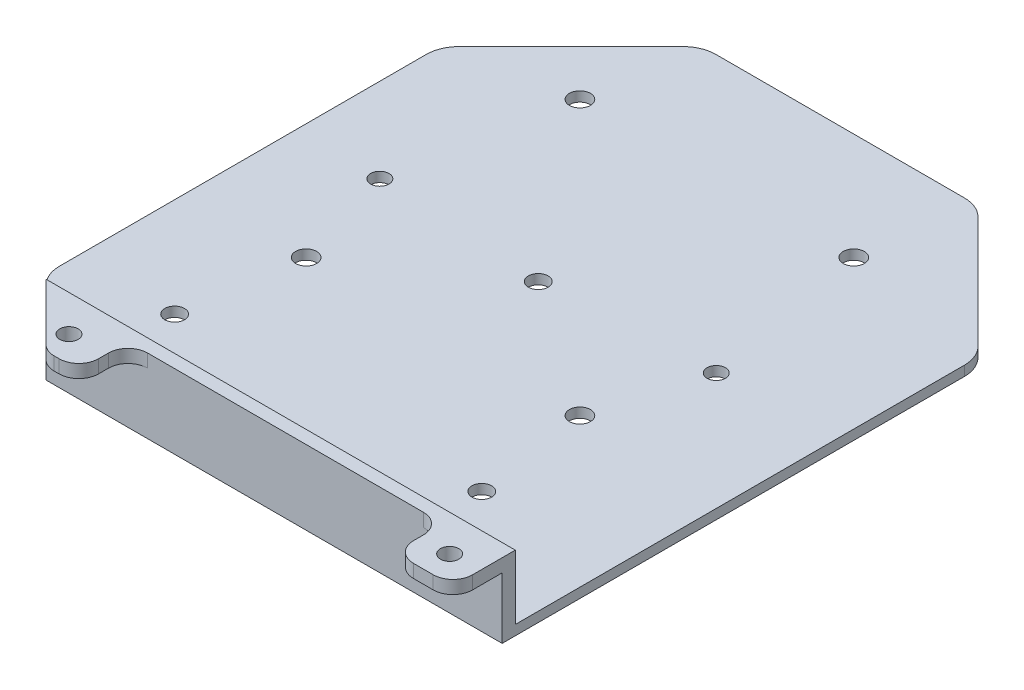
from build123d import *

# Parameters (mm, degrees)
CROQUIS1_W              = 82
CROQUIS1_H              = 90.5
CROQUIS1_R              = 1.4
SALIENTE_EXTRUIR1_DEPTH = 1.5
CROQUIS1_3_W            = 82
CROQUIS1_3_H            = 2
SALIENTE_EXTRUIR2_DEPTH = 9.31
SALIENTE_EXTRUIR3_START = 9.31
CROQUIS1_4_W            = 82
CROQUIS1_4_H            = 7.5
CROQUIS1_4_R            = 1.4
CROQUIS1_4_H_2          = 2
SALIENTE_EXTRUIR3_DEPTH = 2
CROQUIS2_R              = 1.5
CROQUIS2_R_2            = 1.6
CORTAR_EXTRUIR1_DEPTH   = 1.5
CROQUIS3_W              = 48
CROQUIS3_H              = 7.5
CORTAR_EXTRUIR2_DEPTH   = 87.58467604
REDONDEO1_R             = 5
REDONDEO2_R             = 3


with BuildPart() as part:
    # Croquis1 → Saliente-Extruir1 (new body)
    with BuildSketch(Plane(origin=(0, 0, 0), x_dir=(1, 0, 0), z_dir=(0, 1, 0))):
        with Locations((2.5, 28.755)):
            Rectangle(CROQUIS1_W, CROQUIS1_H)
        with Locations(Location((-25.63, 31.995, 0), (0, 0, 270))):
            Circle(CROQUIS1_R, mode=Mode.SUBTRACT)
        with Locations(Location((25.63, 31.995, 0), (0, 0, 270))):
            Circle(CROQUIS1_R, mode=Mode.SUBTRACT)
    extrude(amount=SALIENTE_EXTRUIR1_DEPTH)

    # Croquis2 → Cortar-Extruir1 (cut)
    with BuildSketch(Plane(origin=(0, 1.5, 0), x_dir=(1, 0, 0), z_dir=(0, 1, 0))):
        with Locations(Location((-23.4, -1.495, 0), (0, 0, 270))):
            Circle(CROQUIS2_R)
        with Locations(Location((23.4, -1.495, 0), (0, 0, 270))):
            Circle(CROQUIS2_R)
        with Locations(Location((0, 30.505, 0), (0, 0, 270))):
            Circle(CROQUIS2_R)
        with Locations(Location((-20.86, 57.715, 0), (0, 0, 270))):
            Circle(CROQUIS2_R_2)
        with Locations(Location((20.86, 57.715, 0), (0, 0, 270))):
            Circle(CROQUIS2_R_2)
        with Locations(Location((20.86, 15.995, 0), (0, 0, 270))):
            Circle(CROQUIS2_R_2)
        with Locations(Location((-20.86, 15.995, 0), (0, 0, 270))):
            Circle(CROQUIS2_R_2)
    extrude(amount=-CORTAR_EXTRUIR1_DEPTH, mode=Mode.SUBTRACT)


with BuildPart() as body_2:
    # Croquis1<3> → Saliente-Extruir2 (new body)
    with BuildSketch(Plane(origin=(0, 0, 0), x_dir=(1, 0, 0), z_dir=(0, 1, 0))):
        with Locations((2.5, -17.495)):
            Rectangle(CROQUIS1_3_W, CROQUIS1_3_H)
    extrude(amount=SALIENTE_EXTRUIR2_DEPTH)

    # Croquis1<4> → Saliente-Extruir3 (add)
    # profile 1 of 2: a face of its own
    with BuildSketch(Plane(origin=(0, 0, 0), x_dir=(1, 0, 0), z_dir=(0, 1, 0)).offset(SALIENTE_EXTRUIR3_START)):
        with Locations((2.5, -22.245)):
            Rectangle(CROQUIS1_4_W, CROQUIS1_4_H)
        with Locations(Location((-19, -21.995, 0), (0, 0, 270))):
            Circle(CROQUIS1_4_R, mode=Mode.SUBTRACT)
        with Locations(Location((39, -21.995, 0), (0, 0, 270))):
            Circle(CROQUIS1_4_R, mode=Mode.SUBTRACT)
    # profile 2 of 2: a face of its own
    with BuildSketch(Plane(origin=(0, 0, 0), x_dir=(1, 0, 0), z_dir=(0, 1, 0)).offset(SALIENTE_EXTRUIR3_START)):
        with Locations((2.5, -17.495)):
            Rectangle(CROQUIS1_4_W, CROQUIS1_4_H_2)
    extrude(amount=SALIENTE_EXTRUIR3_DEPTH)

    # Combinar1: union part
    add(part.part)

    # Croquis3 → Cortar-Extruir2 (cut, through all)
    with BuildSketch(Plane(origin=(0, 11.31, 0), x_dir=(1, 0, 0), z_dir=(0, 1, 0))):
        Polygon((-18.5, -25.995), (-28, -16.495), (-38.5, -16.495), (-38.5, -25.995), align=None)
        Polygon((-28, -16.495), (-38.5, -5.995), (-38.5, -16.495), align=None)
        with Locations((10.5, -22.245)):
            Rectangle(CROQUIS3_W, CROQUIS3_H)
        Polygon((-38.5, 54.005), (-18.5, 74.005), (-38.5, 74.005), align=None)
        Polygon((23.5, 74.005), (43.5, 54.005), (43.5, 74.005), align=None)
    extrude(amount=-CORTAR_EXTRUIR2_DEPTH, mode=Mode.SUBTRACT)

    # Redondeo1
    redondeo1_edges = [body_2.edges().sort_by_distance(p)[0] for p in [
        (23.5, 0.75, -74.005),
        (43.5, 0.75, -54.005),
        (-38.5, 0.75, 5.995),
        (-18.5, 0.75, -74.005),
        (-38.5, 0.75, -54.005),
    ]]
    fillet(redondeo1_edges, radius=REDONDEO1_R)

    # Redondeo2
    redondeo2_edges = [body_2.edges().sort_by_distance(p)[0] for p in [
        (-18.5, 10.31, 25.995),
        (43.5, 10.31, 25.995),
        (34.5, 10.31, 18.495),
        (-13.5, 10.31, 25.995),
        (-13.5, 10.31, 18.495),
        (34.5, 10.31, 25.995),
    ]]
    fillet(redondeo2_edges, radius=REDONDEO2_R)


solid = body_2.part
